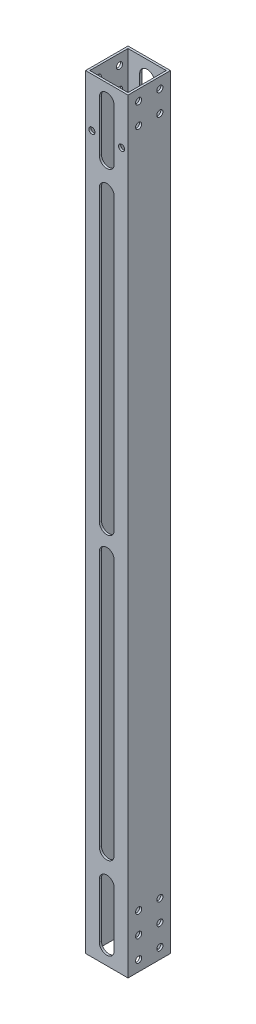
from build123d import *

# Parameters (mm, degrees)
SKETCH_11_W         = 20
SKETCH_11_H         = 20
SKETCH_11_W_2       = 18
SKETCH_11_H_2       = 18
F_20X20X1_1_DEPTH   = 360
SKETCH_12_R         = 1.45
CUT_EXTRUDE_1_DEPTH = 34
SKETCH_13_R         = 1.45
CUT_EXTRUDE_2_DEPTH = 361.693775937
CUT_EXTRUDE_3_DEPTH = 361.693775937


with BuildPart() as part:
    # 草图11 → 铝管 20X20X1(1) (new body)
    with BuildSketch(Plane(origin=(0, 0, 0), x_dir=(-1, 0, 0), z_dir=(0, 1, 0))):
        Rectangle(SKETCH_11_W, SKETCH_11_H)
        Rectangle(SKETCH_11_W_2, SKETCH_11_H_2, mode=Mode.SUBTRACT)
    extrude(amount=F_20X20X1_1_DEPTH)

    # 草图12 → 切除-拉伸1 (cut)
    with BuildSketch(Plane(origin=(10, 0, 0), x_dir=(0, 0, -1), z_dir=(1, 0, 0))):
        with Locations((-5, 355)):
            Circle(SKETCH_12_R)
        with Locations((5, 355)):
            Circle(SKETCH_12_R)
        with Locations((-5, 345)):
            Circle(SKETCH_12_R)
        with Locations((5, 345)):
            Circle(SKETCH_12_R)
        with Locations((5, 5)):
            Circle(SKETCH_12_R)
        with Locations((5, 15)):
            Circle(SKETCH_12_R)
        with Locations((5, 25)):
            Circle(SKETCH_12_R)
        with Locations(Location((-5, 5, 0), (0, 0, 180))):
            Circle(SKETCH_12_R)
        with Locations(Location((-5, 15, 0), (0, 0, 180))):
            Circle(SKETCH_12_R)
        with Locations(Location((-5, 25, 0), (0, 0, 180))):
            Circle(SKETCH_12_R)
    extrude(amount=-CUT_EXTRUDE_1_DEPTH, mode=Mode.SUBTRACT)

    # 草图13 → 切除-拉伸2 (cut, through all)
    with BuildSketch(Plane.XY.offset(10)):
        with Locations((-7, 337)):
            Circle(SKETCH_13_R)
        with Locations((7, 337)):
            Circle(SKETCH_13_R)
    extrude(amount=-CUT_EXTRUDE_2_DEPTH, mode=Mode.SUBTRACT)

    # 草图15 → 切除-拉伸3 (cut, through all)
    with BuildSketch(Plane.XY.offset(10)):
        with BuildLine():
            Line((3.5, 33.508109575), (3.5, 7.836953166))
            ThreePointArc((3.5, 7.836953166), (0, 4.336953166), (-3.5, 7.836953166))
            Line((-3.5, 7.836953166), (-3.5, 33.508109575))
            ThreePointArc((-3.5, 33.508109575), (0, 37.008109575), (3.5, 33.508109575))
        make_face()
        with BuildLine():
            Line((-3.5, 46.653630173), (-3.5, 167.118748463))
            ThreePointArc((-3.5, 167.118748463), (0, 170.618748463), (3.5, 167.118748463))
            Line((3.5, 167.118748463), (3.5, 46.653630173))
            ThreePointArc((3.5, 46.653630173), (0, 43.153630173), (-3.5, 46.653630173))
        make_face()
        with BuildLine():
            Line((-3.5, 179.232346303), (-3.5, 315.472332253))
            ThreePointArc((-3.5, 315.472332253), (0, 318.972332253), (3.5, 315.472332253))
            Line((3.5, 315.472332253), (3.5, 179.232346303))
            ThreePointArc((3.5, 179.232346303), (0, 175.732346303), (-3.5, 179.232346303))
        make_face()
        with BuildLine():
            Line((-3.5, 328.562220872), (-3.5, 352.513931961))
            ThreePointArc((-3.5, 352.513931961), (0, 356.013931961), (3.5, 352.513931961))
            Line((3.5, 352.513931961), (3.5, 328.562220872))
            ThreePointArc((3.5, 328.562220872), (0, 325.062220872), (-3.5, 328.562220872))
        make_face()
    extrude(amount=-CUT_EXTRUDE_3_DEPTH, mode=Mode.SUBTRACT)


solid = part.part
